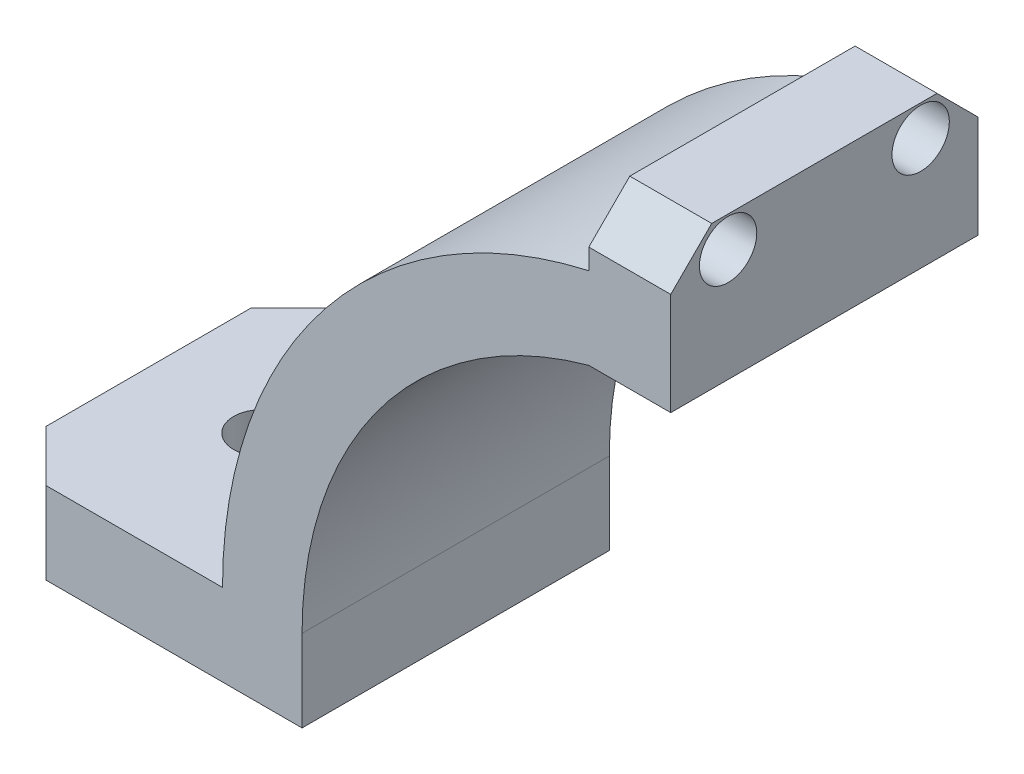
from build123d import *

# Parameters (mm, degrees)
BOSS_EXTRUDE1_DEPTH = 15
CHAMFER1_SIZE       = 2.5
SKETCH2_R           = 1.4
CUT_EXTRUDE1_DEPTH  = 15
CHAMFER2_SIZE       = 2
SKETCH3_R           = 1.4
CUT_EXTRUDE2_DEPTH  = 45.973594908


with BuildPart() as part:
    # Sketch1 → Boss-Extrude1 (new body)
    with BuildSketch(Plane.XY):
        with BuildLine():
            Line((-19, 0), (-19, -4))
            Line((-19, -4), (-34, -4))
            Line((-34, -4), (-34, 0))
            Line((-34, 0), (-22.883234523, 0))
            ThreePointArc((-22.883234523, 0), (-17.861391251, 14.304304416), (-5, 22.33030278))
            Line((-5, 22.33030278), (-5, 25.33030278))
            Line((-5, 25.33030278), (-1, 25.33030278))
            Line((-1, 25.33030278), (-1, 18.33030278))
            Line((-1, 18.33030278), (-5, 18.33030278))
            ThreePointArc((-5, 18.33030278), (-15.099668871, 11.532562595), (-19, 0))
        make_face()
    extrude(amount=BOSS_EXTRUDE1_DEPTH)

    # Chamfer1
    chamfer1_edges = [part.edges().sort_by_distance(p)[0] for p in [
        (-34, -2, 0),
        (-34, -2, 15),
    ]]
    chamfer(chamfer1_edges, length=CHAMFER1_SIZE)

    # Sketch2 → Cut-Extrude1 (cut)
    with BuildSketch(Plane.ZY.offset(5)):
        with Locations(Location((2.8, 23.83030278, 0), (0, 0, 270))):
            Circle(SKETCH2_R)
        with Locations(Location((12.2, 23.83030278, 0), (0, 0, 270))):
            Circle(SKETCH2_R)
    extrude(amount=-CUT_EXTRUDE1_DEPTH, mode=Mode.SUBTRACT)

    # Chamfer2
    chamfer2_edges = [part.edges().sort_by_distance(p)[0] for p in [
        (-3, 25.33030278, 0),
        (-3, 25.33030278, 15),
    ]]
    chamfer(chamfer2_edges, length=CHAMFER2_SIZE)

    # Sketch3 → Cut-Extrude2 (cut, through all)
    with BuildSketch(Plane(origin=(0, 0, 0), x_dir=(1, 0, 0), z_dir=(0, 1, 0))):
        with Locations(Location((-28.441617262, -7.5, 0), (0, 0, 270))):
            Circle(SKETCH3_R)
    extrude(amount=-CUT_EXTRUDE2_DEPTH, mode=Mode.SUBTRACT)


solid = part.part
